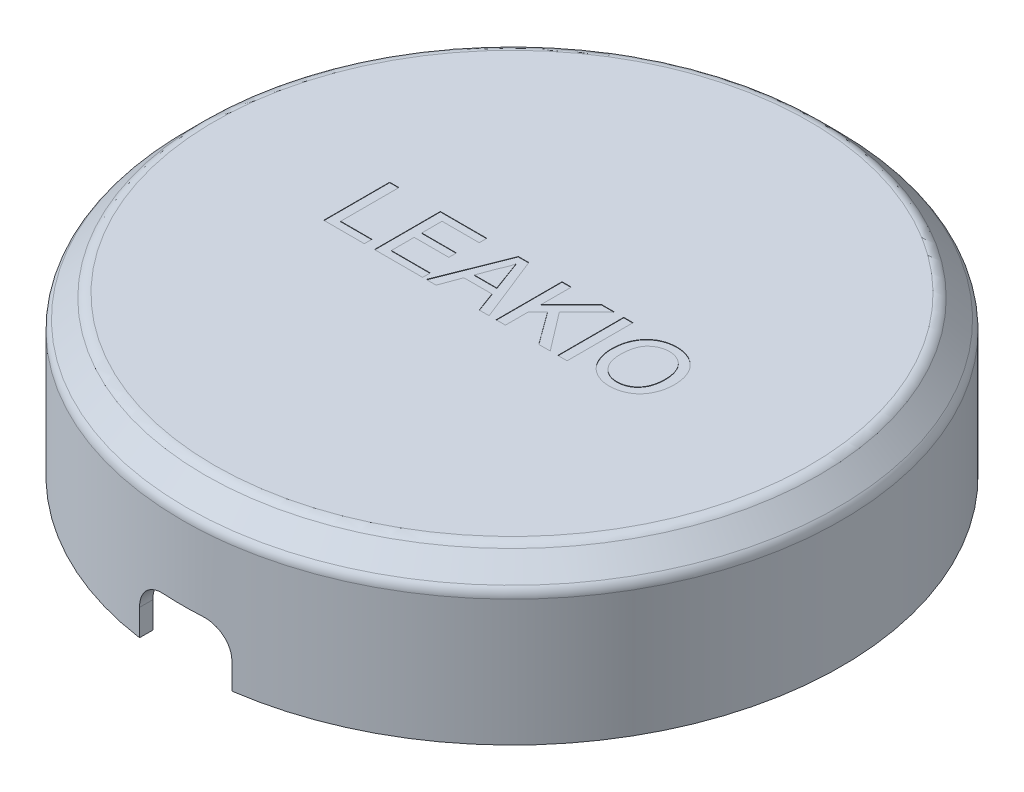
from build123d import *

# Parameters (mm, degrees)
SKETCH1_R           = 25
BOSS_EXTRUDE1_DEPTH = 12
CHAMFER1_SIZE       = 2
SHELL2_T            = -1
SKETCH4_W           = 0.705128205
SKETCH4_H           = 5
CUT_EXTRUDE1_DEPTH  = 0.05
SKETCH5_W           = 0.705128205
SKETCH5_H           = 5
BOSS_EXTRUDE2_DEPTH = 0.02
SKETCH6_W           = 7
SKETCH6_H           = 4
CUT_EXTRUDE2_DEPTH  = 38.336309437
FILLET1_R           = 2
SKETCH7_R           = 1.5
BOSS_EXTRUDE3_DEPTH = 11
SKETCH8_W           = 2
SKETCH8_H           = 20
BOSS_EXTRUDE4_DEPTH = 2
SKETCH9_R           = 1
CUT_EXTRUDE3_DEPTH  = 4
FILLET2_R           = 1


with BuildPart() as part:
    # Sketch1 → Boss-Extrude1 (new body)
    with BuildSketch(Plane(origin=(0, 0, 0), x_dir=(1, 0, 0), z_dir=(0, 1, 0))):
        with Locations(Location((0, 0, 0), (0, 0, 270))):
            Circle(SKETCH1_R)
    extrude(amount=BOSS_EXTRUDE1_DEPTH)

    # Chamfer1
    chamfer1_edges = [part.edges().sort_by_distance(p)[0] for p in [
        (0, 12, -25),
    ]]
    chamfer(chamfer1_edges, length=CHAMFER1_SIZE)

    # Shell2
    shell2_openings = [part.faces().sort_by_distance(p)[0] for p in [
        (0, 0, 0),
    ]]
    offset(amount=SHELL2_T, openings=shell2_openings, kind=Kind.INTERSECTION)

    # Sketch4 → Cut-Extrude1 (cut)
    # profile 1 of 6: a face of its own
    with BuildSketch(Plane(origin=(0, 12, 0), x_dir=(1, 0, 0), z_dir=(0, 1, 0))):
        Polygon((-11.943543433, -2.336940839), (-11.943543433, 2.663059161), (-11.238415228, 2.663059161), (-11.238415228, -1.760017762), (-8.866620356, -1.760017762), (-8.866620356, -2.336940839), align=None)
    # profile 2 of 6: a face of its own
    with BuildSketch(Plane(origin=(0, 12, 0), x_dir=(1, 0, 0), z_dir=(0, 1, 0))):
        Polygon((-8.097389587, -2.336940839), (-8.097389587, 2.663059161), (-4.571748562, 2.663059161), (-4.571748562, 2.086136084), (-7.392261382, 2.086136084), (-7.392261382, 0.547674546), (-4.764056254, 0.547674546), (-4.764056254, -0.029248531), (-7.392261382, -0.029248531), (-7.392261382, -1.760017762), (-4.443543433, -1.760017762), (-4.443543433, -2.336940839), align=None)
    # profile 3 of 6: a face of its own
    with BuildSketch(Plane(origin=(0, 12, 0), x_dir=(1, 0, 0), z_dir=(0, 1, 0))):
        Polygon((-4.166099523, -2.336940839), (-2.180923241, 2.663059161), (-1.385650805, 2.663059161), (0.599525477, -2.336940839), (-0.148671638, -2.336940839), (-0.717581895, -0.7984793), (-2.848992151, -0.7984793), (-3.417902408, -2.336940839), align=None)
        with BuildLine():
            Line((-2.636652408, -0.221556223), (-0.929921638, -0.221556223))
            Line((-0.929921638, -0.221556223), (-1.415698882, 1.092546341))
            add(Edge.make_bspline(
                [(-1.415698882, 1.092546341), (-1.434321847, 1.143321473), (-1.47073326, 1.242596444), (-1.525033647, 1.386834595), (-1.574641606, 1.523809064), (-1.623286283, 1.651555833), (-1.667198701, 1.771930552), (-1.707673903, 1.884120143), (-1.747703536, 1.987344837), (-1.771725882, 2.054038625), (-1.783287023, 2.086136084)],
                knots=[0, 0, 0, 0, 1.225184869, 2.395467751, 3.491410812, 4.525364584, 5.492066482, 6.394148129, 7.227157926, 8, 8, 8, 8], degree=3))
            add(Edge.make_bspline(
                [(-1.783287023, 2.086136084), (-1.802411382, 2.006986576), (-1.840738954, 1.8483612), (-1.92098756, 1.615953746), (-2.012789177, 1.385671762), (-2.087343029, 1.237279624), (-2.124833497, 1.16265852)],
                knots=[0, 0, 0, 0, 0.9891762, 1.982431084, 2.985436691, 4, 4, 4, 4], degree=3))
            Line((-2.124833497, 1.16265852), (-2.636652408, -0.221556223))
        make_face(mode=Mode.SUBTRACT)
    # profile 4 of 6: a face of its own
    with BuildSketch(Plane(origin=(0, 12, 0), x_dir=(1, 0, 0), z_dir=(0, 1, 0))):
        Polygon((1.133379644, -2.336940839), (1.133379644, 2.663059161), (1.838507849, 2.663059161), (1.838507849, 0.359373264), (4.142193746, 2.663059161), (5.107738618, 2.663059161), (3.018395669, 0.573716212), (5.235943746, -2.336940839), (4.367554323, -2.336940839), (2.571680926, 0.125999866), (1.838507849, -0.606171608), (1.838507849, -2.336940839), align=None)
    # profile 5 of 6: a face of its own
    with BuildSketch(Plane(origin=(0, 12, 0), x_dir=(1, 0, 0), z_dir=(0, 1, 0))):
        with Locations((6.165430926, 0.163059161)):
            Rectangle(SKETCH4_W, SKETCH4_H)
    # profile 6 of 6: a face of its own
    with BuildSketch(Plane(origin=(0, 12, 0), x_dir=(1, 0, 0), z_dir=(0, 1, 0))):
        with BuildLine():
            add(Edge.make_bspline(
                [(7.415430926, 0.096953392), (7.417168733, 0.197199082), (7.420554763, 0.392522726), (7.452192266, 0.67693912), (7.50356345, 0.944537743), (7.577003103, 1.195297747), (7.670088074, 1.429612074), (7.783250639, 1.648011295), (7.919894652, 1.848023286), (8.074473851, 2.031552032), (8.247131716, 2.193804896), (8.430963269, 2.337908685), (8.628263989, 2.458108282), (8.837210968, 2.557353522), (9.058691932, 2.633551144), (9.29208503, 2.686896413), (9.537140649, 2.721309295), (9.7046419, 2.725182579), (9.790230605, 2.727161725)],
                knots=[0, 0, 0, 0, 1.203621547, 2.345195544, 3.432004029, 4.472479546, 5.478447225, 6.455936844, 7.420185704, 8.381829745, 9.332027588, 10.260832629, 11.182364398, 12.100723901, 13.034044877, 13.989196293, 14.972532542, 16, 16, 16, 16], degree=3))
            add(Edge.make_bspline(
                [(9.790230605, 2.727161725), (9.846682237, 2.726175974), (9.958784968, 2.724218449), (10.12451885, 2.7093243), (10.285993955, 2.682740824), (10.443051269, 2.647115986), (10.596118304, 2.600377747), (10.745286468, 2.545204679), (10.889249961, 2.476837478), (11.028966533, 2.400293594), (11.162786934, 2.31467595), (11.288551012, 2.220094312), (11.405957522, 2.117263997), (11.516583552, 2.007875255), (11.616737667, 1.888236369), (11.710557488, 1.761991745), (11.795347047, 1.62690286), (11.871407198, 1.484076539), (11.939412701, 1.335718709), (11.997536536, 1.181214487), (12.047446413, 1.022417258), (12.08922519, 0.858387114), (12.11920259, 0.689180131), (12.143073918, 0.515525405), (12.155638057, 0.336855374), (12.15788362, 0.216160584), (12.159020669, 0.155046341)],
                knots=[0, 0, 0, 0, 1.034375294, 2.054082248, 3.045783978, 4.031219655, 5.002789406, 5.976610191, 6.94273282, 7.920236376, 8.894345378, 9.851183672, 10.800797181, 11.752517031, 12.698794154, 13.65688337, 14.632873302, 15.61821402, 16.620222298, 17.621258913, 18.640965868, 19.669244166, 20.720417492, 21.788124603, 22.880008887, 24, 24, 24, 24], degree=3))
            add(Edge.make_bspline(
                [(12.159020669, 0.155046341), (12.157978885, 0.092924322), (12.15592066, -0.029808438), (12.141993867, -0.211122276), (12.117505725, -0.38723097), (12.085026374, -0.558659643), (12.041505036, -0.725051418), (11.989786613, -0.886883349), (11.927230258, -1.043191534), (11.856579801, -1.194352707), (11.776638839, -1.338287878), (11.688458533, -1.473990583), (11.591976414, -1.600191433), (11.488658033, -1.718438588), (11.376090634, -1.826617568), (11.255660328, -1.925739927), (11.127830171, -2.016740501), (10.992170718, -2.097154709), (10.851116563, -2.167640635), (10.707458945, -2.23017435), (10.561091153, -2.283505591), (10.411512945, -2.326725261), (10.259132357, -2.359385154), (10.104378205, -2.383841227), (9.946743184, -2.397923117), (9.840671494, -2.399997963), (9.787225797, -2.401043403)],
                knots=[0, 0, 0, 0, 1.141429366, 2.255090526, 3.338676798, 4.407031443, 5.458968682, 6.496860253, 7.526652771, 8.550250826, 9.560787671, 10.54935636, 11.521089193, 12.477323897, 13.431786008, 14.386110112, 15.340986122, 16.312041, 17.28047646, 18.236612773, 19.189437236, 20.140779471, 21.09494583, 22.051062463, 23.018000708, 24, 24, 24, 24], degree=3))
            add(Edge.make_bspline(
                [(9.787225797, -2.401043403), (9.729759803, -2.400193186), (9.615934059, -2.39850912), (9.447696545, -2.381699271), (9.283644516, -2.356055261), (9.1242549, -2.319033057), (8.969745496, -2.270734977), (8.819933486, -2.212276509), (8.674291965, -2.144438932), (8.534628101, -2.065279834), (8.401417256, -1.977263427), (8.275950555, -1.880827235), (8.158297377, -1.776860005), (8.050345575, -1.66364328), (7.94859893, -1.545281213), (7.857125728, -1.417374357), (7.772938599, -1.282823508), (7.698528778, -1.140331651), (7.631310639, -0.994133107), (7.574677906, -0.844181109), (7.524908709, -0.692685551), (7.485272582, -0.538712678), (7.453687411, -0.38261767), (7.432448673, -0.224660265), (7.417109895, -0.064605211), (7.415993398, 0.042829518), (7.415430926, 0.096953392)],
                knots=[0, 0, 0, 0, 1.072727997, 2.12480551, 3.153819198, 4.171534612, 5.177148798, 6.173931848, 7.17235114, 8.174500385, 9.168706755, 10.151274001, 11.127173509, 12.097141049, 13.070188938, 14.039134204, 15.03036519, 16.031505612, 17.038625933, 18.033164522, 19.022845559, 20.014762458, 21.000193215, 21.994692725, 22.989758729, 24, 24, 24, 24], degree=3))
        make_face()
        with BuildLine():
            add(Edge.make_bspline(
                [(8.120559131, 0.088940571), (8.121639706, 0.01675463), (8.123746752, -0.124002863), (8.1478525, -0.329219801), (8.184429122, -0.522852434), (8.234846134, -0.705444333), (8.302618946, -0.875189693), (8.383650116, -1.033719601), (8.480667985, -1.17998024), (8.591532049, -1.313562463), (8.71346981, -1.433562722), (8.843772682, -1.538376565), (8.982469958, -1.626150745), (9.12802393, -1.698627068), (9.281480045, -1.755201446), (9.442378701, -1.79492655), (9.610838116, -1.819771377), (9.725706663, -1.822652616), (9.78422099, -1.824120326)],
                knots=[0, 0, 0, 0, 1.215430442, 2.370003584, 3.475209778, 4.53279855, 5.55522989, 6.548792651, 7.526809858, 8.505409025, 9.467826767, 10.404123909, 11.316848639, 12.227335424, 13.138360512, 14.065900994, 15.014765094, 16, 16, 16, 16], degree=3))
            add(Edge.make_bspline(
                [(9.78422099, -1.824120326), (9.843727137, -1.822630907), (9.960240006, -1.81971463), (10.131239176, -1.795303514), (10.293707529, -1.753744631), (10.449255418, -1.698420343), (10.595070687, -1.623631336), (10.734563538, -1.536053819), (10.863931379, -1.429036602), (10.986349823, -1.308824109), (11.096150922, -1.172180533), (11.193576281, -1.02247184), (11.272717786, -0.85745278), (11.341045794, -0.680758497), (11.391079499, -0.489049402), (11.428057473, -0.284504842), (11.450341183, -0.066466861), (11.452687772, 0.083212167), (11.453892464, 0.160054354)],
                knots=[0, 0, 0, 0, 0.976878588, 1.912725521, 2.8289017, 3.727303729, 4.617335839, 5.514666588, 6.426584173, 7.368641557, 8.327632997, 9.299405846, 10.294892156, 11.327373912, 12.405931897, 13.542618837, 14.738430195, 16, 16, 16, 16], degree=3))
            add(Edge.make_bspline(
                [(11.453892464, 0.160054354), (11.453466727, 0.209489615), (11.452631583, 0.306463708), (11.441571491, 0.44940463), (11.427305391, 0.587899272), (11.405585031, 0.721768925), (11.37565162, 0.850459204), (11.342490483, 0.974949831), (11.301023642, 1.094168015), (11.253973731, 1.208581284), (11.201325678, 1.317602261), (11.141945676, 1.420311857), (11.076523842, 1.516310759), (11.006825335, 1.607419009), (10.928990644, 1.690110345), (10.846767557, 1.767877687), (10.758288378, 1.839114345), (10.664436098, 1.903838927), (10.566542133, 1.962101251), (10.46480829, 2.011966241), (10.360855335, 2.05576637), (10.252943242, 2.089341007), (10.142562069, 2.116419444), (10.029265596, 2.13698804), (9.912633297, 2.147639416), (9.833985849, 2.149366016), (9.794237015, 2.150238648)],
                knots=[0, 0, 0, 0, 1.220438779, 2.394059227, 3.538503547, 4.658058814, 5.74010225, 6.800155734, 7.837851593, 8.854470756, 9.853724944, 10.825214244, 11.781044712, 12.72106398, 13.654479919, 14.581868691, 15.514082315, 16.456304431, 17.39516604, 18.324312202, 19.252140633, 20.177768678, 21.111585046, 22.057694709, 23.018348693, 24, 24, 24, 24], degree=3))
            add(Edge.make_bspline(
                [(9.794237015, 2.150238648), (9.738057461, 2.149122945), (9.627208941, 2.146921537), (9.464026723, 2.12244947), (9.306701371, 2.085884859), (9.154988735, 2.034765584), (9.010186388, 1.967075631), (8.871544123, 1.884063166), (8.737831285, 1.78798849), (8.611156335, 1.676510763), (8.493067575, 1.548450067), (8.393235375, 1.397470432), (8.309094069, 1.227176056), (8.238837629, 1.037998599), (8.185269162, 0.828473004), (8.148246652, 0.599500959), (8.124871394, 0.350841184), (8.122033299, 0.178472608), (8.120559131, 0.088940571)],
                knots=[0, 0, 0, 0, 0.895090134, 1.766112571, 2.624765742, 3.468151641, 4.313618154, 5.168136083, 6.041303099, 6.935189387, 7.854749729, 8.809996334, 9.809869957, 10.877771942, 12.021723904, 13.25217762, 14.572720513, 16, 16, 16, 16], degree=3))
        make_face(mode=Mode.SUBTRACT)
    extrude(amount=-CUT_EXTRUDE1_DEPTH, mode=Mode.SUBTRACT)

    # Sketch5 → Boss-Extrude2 (add)
    # profile 1 of 6: a face of its own
    with BuildSketch(Plane(origin=(0, 11.95, 0), x_dir=(1, 0, 0), z_dir=(0, 1, 0))):
        with Locations((6.165430926, 0.163059161)):
            Rectangle(SKETCH5_W, SKETCH5_H)
    # profile 2 of 6: a face of its own
    with BuildSketch(Plane(origin=(0, 11.95, 0), x_dir=(1, 0, 0), z_dir=(0, 1, 0))):
        Polygon((1.133379644, -2.336940839), (1.838507849, -2.336940839), (1.838507849, -0.606171608), (2.571680926, 0.125999866), (4.367554323, -2.336940839), (5.235943746, -2.336940839), (3.018395669, 0.573716212), (5.107738618, 2.663059161), (4.142193746, 2.663059161), (1.838507849, 0.359373264), (1.838507849, 2.663059161), (1.133379644, 2.663059161), align=None)
    # profile 3 of 6: a face of its own
    with BuildSketch(Plane(origin=(0, 11.95, 0), x_dir=(1, 0, 0), z_dir=(0, 1, 0))):
        Polygon((-4.166099523, -2.336940839), (-3.417902408, -2.336940839), (-2.848992151, -0.7984793), (-0.717581895, -0.7984793), (-0.148671638, -2.336940839), (0.599525477, -2.336940839), (-1.385650805, 2.663059161), (-2.180923241, 2.663059161), align=None)
        with BuildLine():
            Line((-2.124833497, 1.16265852), (-2.636652408, -0.221556223))
            Line((-2.636652408, -0.221556223), (-0.929921638, -0.221556223))
            Line((-0.929921638, -0.221556223), (-1.415698882, 1.092546341))
            add(Edge.make_bspline(
                [(-1.415698882, 1.092546341), (-1.434321847, 1.143321473), (-1.47073326, 1.242596444), (-1.525033647, 1.386834595), (-1.574641606, 1.523809064), (-1.623286283, 1.651555833), (-1.667198701, 1.771930552), (-1.707673903, 1.884120143), (-1.747703536, 1.987344837), (-1.771725882, 2.054038625), (-1.783287023, 2.086136084)],
                knots=[0, 0, 0, 0, 0.153148109, 0.299433469, 0.436426351, 0.565670573, 0.68650831, 0.799268516, 0.903394741, 1, 1, 1, 1], degree=3))
            add(Edge.make_bspline(
                [(-1.783287023, 2.086136084), (-1.802411382, 2.006986576), (-1.840738954, 1.8483612), (-1.92098756, 1.615953746), (-2.012789177, 1.385671762), (-2.087343029, 1.237279624), (-2.124833497, 1.16265852)],
                knots=[0, 0, 0, 0, 0.24729405, 0.495607771, 0.746359173, 1, 1, 1, 1], degree=3))
        make_face(mode=Mode.SUBTRACT)
    # profile 4 of 6: a face of its own
    with BuildSketch(Plane(origin=(0, 11.95, 0), x_dir=(1, 0, 0), z_dir=(0, 1, 0))):
        Polygon((-11.943543433, -2.336940839), (-8.866620356, -2.336940839), (-8.866620356, -1.760017762), (-11.238415228, -1.760017762), (-11.238415228, 2.663059161), (-11.943543433, 2.663059161), align=None)
    # profile 5 of 6: a face of its own
    with BuildSketch(Plane(origin=(0, 11.95, 0), x_dir=(1, 0, 0), z_dir=(0, 1, 0))):
        Polygon((-8.097389587, -2.336940839), (-4.443543433, -2.336940839), (-4.443543433, -1.760017762), (-7.392261382, -1.760017762), (-7.392261382, -0.029248531), (-4.764056254, -0.029248531), (-4.764056254, 0.547674546), (-7.392261382, 0.547674546), (-7.392261382, 2.086136084), (-4.571748562, 2.086136084), (-4.571748562, 2.663059161), (-8.097389587, 2.663059161), align=None)
    # profile 6 of 6: a face of its own
    with BuildSketch(Plane(origin=(0, 11.95, 0), x_dir=(1, 0, 0), z_dir=(0, 1, 0))):
        with BuildLine():
            add(Edge.make_bspline(
                [(7.415430926, 0.096953392), (7.415993398, 0.042829518), (7.417109895, -0.064605211), (7.432448673, -0.224660265), (7.453687411, -0.38261767), (7.485272582, -0.538712678), (7.524908709, -0.692685551), (7.574677906, -0.844181109), (7.631310639, -0.994133107), (7.698528778, -1.140331651), (7.772938599, -1.282823508), (7.857125728, -1.417374357), (7.94859893, -1.545281213), (8.050345575, -1.66364328), (8.158297377, -1.776860005), (8.275950555, -1.880827235), (8.401417256, -1.977263427), (8.534628101, -2.065279834), (8.674291965, -2.144438932), (8.819933486, -2.212276509), (8.969745496, -2.270734977), (9.1242549, -2.319033057), (9.283644516, -2.356055261), (9.447696545, -2.381699271), (9.615934059, -2.39850912), (9.729759803, -2.400193186), (9.787225797, -2.401043403)],
                knots=[0, 0, 0, 0, 0.042093386, 0.08355447, 0.124991949, 0.166051564, 0.207381435, 0.248618145, 0.290057253, 0.332020599, 0.373734784, 0.415036075, 0.455408794, 0.495952456, 0.53636777, 0.57703025, 0.617970552, 0.659395817, 0.701152036, 0.74275284, 0.784285467, 0.826186058, 0.868590867, 0.911466437, 0.955303, 1, 1, 1, 1], degree=3))
            add(Edge.make_bspline(
                [(9.787225797, -2.401043403), (9.840671494, -2.399997963), (9.946743184, -2.397923117), (10.104378205, -2.383841227), (10.259132357, -2.359385154), (10.411512945, -2.326725261), (10.561091153, -2.283505591), (10.707458945, -2.23017435), (10.851116563, -2.167640635), (10.992170718, -2.097154709), (11.127830171, -2.016740501), (11.255660328, -1.925739927), (11.376090634, -1.826617568), (11.488658033, -1.718438588), (11.591976414, -1.600191433), (11.688458533, -1.473990583), (11.776638839, -1.338287878), (11.856579801, -1.194352707), (11.927230258, -1.043191534), (11.989786613, -0.886883349), (12.041505036, -0.725051418), (12.085026374, -0.558659643), (12.117505725, -0.38723097), (12.141993867, -0.211122276), (12.15592066, -0.029808438), (12.157978885, 0.092924322), (12.159020669, 0.155046341)],
                knots=[0, 0, 0, 0, 0.040916637, 0.081205731, 0.121043924, 0.160800855, 0.200440115, 0.240141134, 0.279980147, 0.320331625, 0.360792245, 0.400578745, 0.44034225, 0.480111504, 0.519954617, 0.560443485, 0.601633847, 0.643739549, 0.686389468, 0.729297489, 0.772542972, 0.81637369, 0.860888467, 0.906037895, 0.952440443, 1, 1, 1, 1], degree=3))
            add(Edge.make_bspline(
                [(12.159020669, 0.155046341), (12.15788362, 0.216160584), (12.155638057, 0.336855374), (12.143073918, 0.515525405), (12.11920259, 0.689180131), (12.08922519, 0.858387114), (12.047446413, 1.022417258), (11.997536536, 1.181214487), (11.939412701, 1.335718709), (11.871407198, 1.484076539), (11.795347047, 1.62690286), (11.710557488, 1.761991745), (11.616737667, 1.888236369), (11.516583552, 2.007875255), (11.405957522, 2.117263997), (11.288551012, 2.220094312), (11.162786934, 2.31467595), (11.028966533, 2.400293594), (10.889249961, 2.476837478), (10.745286468, 2.545204679), (10.596118304, 2.600377747), (10.443051269, 2.647115986), (10.285993955, 2.682740824), (10.12451885, 2.7093243), (9.958784968, 2.724218449), (9.846682237, 2.726175974), (9.790230605, 2.727161725)],
                knots=[0, 0, 0, 0, 0.046666296, 0.092161475, 0.136649271, 0.18044816, 0.223293089, 0.265780879, 0.307490738, 0.349241083, 0.390296946, 0.430963193, 0.470883577, 0.51031179, 0.549966784, 0.589534014, 0.629402276, 0.669990151, 0.710719466, 0.750974575, 0.791550441, 0.832032514, 0.873092334, 0.91441324, 0.956901029, 1, 1, 1, 1], degree=3))
            add(Edge.make_bspline(
                [(9.790230605, 2.727161725), (9.7046419, 2.725182579), (9.537140649, 2.721309295), (9.29208503, 2.686896413), (9.058691932, 2.633551144), (8.837210968, 2.557353522), (8.628263989, 2.458108282), (8.430963269, 2.337908685), (8.247131716, 2.193804896), (8.074473851, 2.031552032), (7.919894652, 1.848023286), (7.783250639, 1.648011295), (7.670088074, 1.429612074), (7.577003103, 1.195297747), (7.50356345, 0.944537743), (7.452192266, 0.67693912), (7.420554763, 0.392522726), (7.417168733, 0.197199082), (7.415430926, 0.096953392)],
                knots=[0, 0, 0, 0, 0.064216716, 0.125675232, 0.185372195, 0.243704756, 0.301102225, 0.358697961, 0.416748276, 0.476135641, 0.536238393, 0.596503947, 0.657597048, 0.720470028, 0.785499748, 0.853425278, 0.924773653, 1, 1, 1, 1], degree=3))
        make_face()
    extrude(amount=BOSS_EXTRUDE2_DEPTH)

    # Sketch6 → Cut-Extrude2 (cut, through all)
    with BuildSketch(Plane.XY):
        with Locations((0, 2)):
            Rectangle(SKETCH6_W, SKETCH6_H)
    extrude(amount=CUT_EXTRUDE2_DEPTH, mode=Mode.SUBTRACT)

    # Fillet1
    fillet1_edges = [part.edges().sort_by_distance(p)[0] for p in [
        (-3.5, 4, 24.248603865),
        (3.5, 4, 24.248603865),
    ]]
    fillet(fillet1_edges, radius=FILLET1_R)

    # Sketch7 → Boss-Extrude3 (add)
    with BuildSketch(Plane.XZ.offset(-11)):
        with Locations(Location((-15, 15, 0), (0, 0, 90))):
            Circle(SKETCH7_R)
        with Locations(Location((15, 15, 0), (0, 0, 90))):
            Circle(SKETCH7_R)
        with Locations(Location((-15, -15, 0), (0, 0, 90))):
            Circle(SKETCH7_R)
        with Locations(Location((15, -15, 0), (0, 0, 90))):
            Circle(SKETCH7_R)
    extrude(amount=BOSS_EXTRUDE3_DEPTH)

    # Sketch8 → Boss-Extrude4 (add)
    with BuildSketch(Plane.XZ.offset(-11)):
        with Locations((-15, 0)):
            Rectangle(SKETCH8_W, SKETCH8_H)
        with Locations((15, 0)):
            Rectangle(SKETCH8_W, SKETCH8_H)
    extrude(amount=BOSS_EXTRUDE4_DEPTH)

    # Sketch9 → Cut-Extrude3 (cut)
    with BuildSketch(Plane.XZ):
        with Locations(Location((-15, 15, 0), (0, 0, 270))):
            Circle(SKETCH9_R)
        with Locations(Location((15, 15, 0), (0, 0, 270))):
            Circle(SKETCH9_R)
        with Locations(Location((15, -15, 0), (0, 0, 270))):
            Circle(SKETCH9_R)
        with Locations(Location((-15, -15, 0), (0, 0, 270))):
            Circle(SKETCH9_R)
    extrude(amount=-CUT_EXTRUDE3_DEPTH, mode=Mode.SUBTRACT)

    # Fillet2
    fillet2_edges = [part.edges().sort_by_distance(p)[0] for p in [
        (0, 12, -23),
        (0, 10, -25),
    ]]
    fillet(fillet2_edges, radius=FILLET2_R)


solid = part.part
